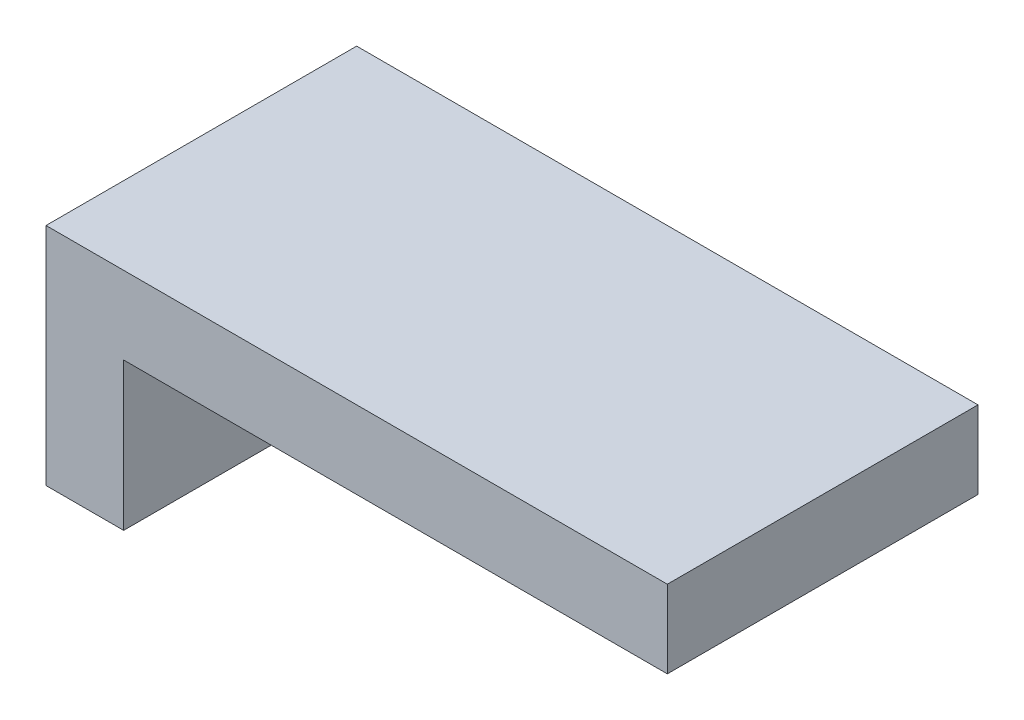
from build123d import *

# Parameters (mm, degrees)
SZKIC1_W                    = 1
SZKIC1_H                    = 4
DODANIE_WYCI_GNI_CIE1_DEPTH = 1.9
SZKIC2_W                    = 1
SZKIC2_H                    = 4
DODANIE_WYCI_GNI_CIE2_DEPTH = 1
SZKIC3_W                    = 4
SZKIC3_H                    = 1
DODANIE_WYCI_GNI_CIE3_DEPTH = 7


with BuildPart() as part:
    # Szkic1 → Dodanie-wyciągnięcie1 (new body)
    with BuildSketch(Plane(origin=(0, 0, 0), x_dir=(1, 0, 0), z_dir=(0, 1, 0))):
        with Locations((-0.5, 2)):
            Rectangle(SZKIC1_W, SZKIC1_H)
    extrude(amount=DODANIE_WYCI_GNI_CIE1_DEPTH)

    # Szkic2 → Dodanie-wyciągnięcie2 (add)
    with BuildSketch(Plane(origin=(0, 1.9, 0), x_dir=(1, 0, 0), z_dir=(0, 1, 0))):
        with Locations((-0.5, 2)):
            Rectangle(SZKIC2_W, SZKIC2_H)
    extrude(amount=DODANIE_WYCI_GNI_CIE2_DEPTH)

    # Szkic3 → Dodanie-wyciągnięcie3 (add)
    with BuildSketch(Plane(origin=(0, 0, 0), x_dir=(0, 0, -1), z_dir=(1, 0, 0))):
        with Locations((2, 2.4)):
            Rectangle(SZKIC3_W, SZKIC3_H)
    extrude(amount=DODANIE_WYCI_GNI_CIE3_DEPTH)


solid = part.part
